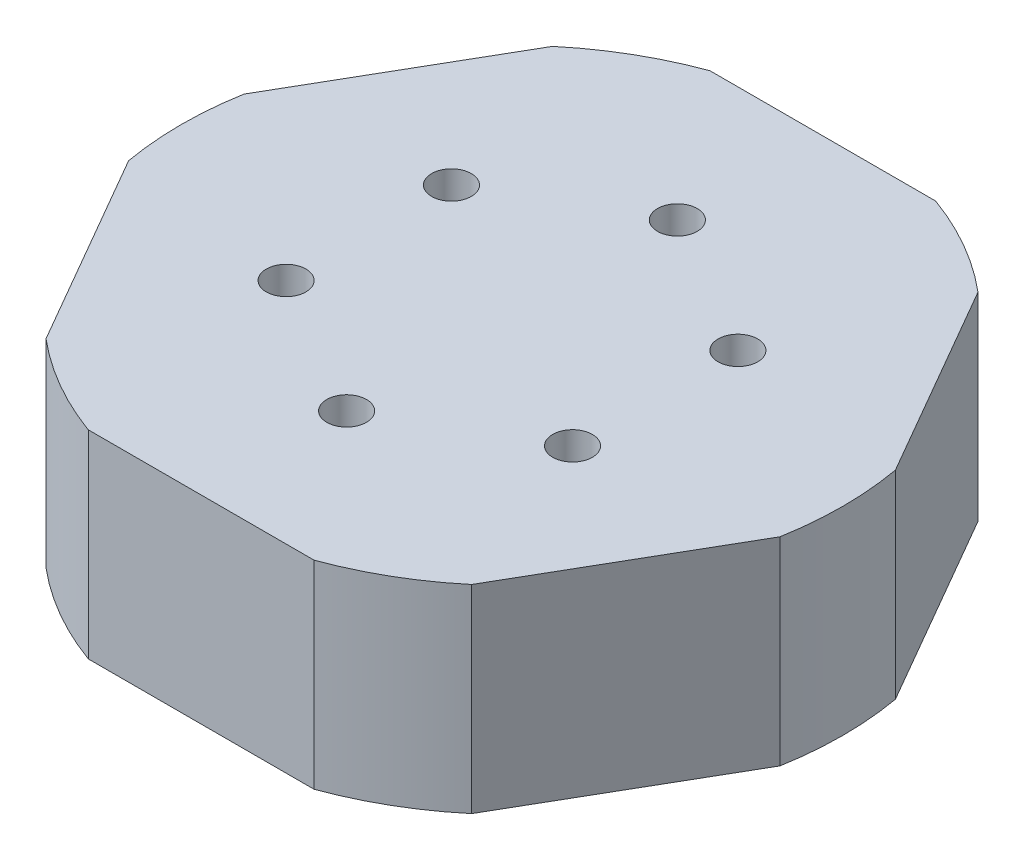
from build123d import *

# Parameters (mm, degrees)
SKETCH2_R                = 40
BOSS_EXTRUDE1_DEPTH      = 10
EXTRUDE_THIN1_DEPTH      = 20
EXTRUDE_THIN1_DEPTH_BACK = 10
SKETCH3_R                = 50
SKETCH3_R_2              = 40
SKETCH4_OUTSIDE_W        = 130.914
SKETCH4_OUTSIDE_H        = 130.914
CUT_EXTRUDE1_DEPTH       = 77.811457479
SKETCH5_R                = 3
CUT_EXTRUDE2_DEPTH       = 75.893257373


with BuildPart() as part:
    # Sketch2 → Boss-Extrude1 (new body)
    with BuildSketch(Plane(origin=(0, 0, 0), x_dir=(1, 0, 0), z_dir=(0, 1, 0))):
        with Locations(Location((0, 0, 0), (0, 0, 270))):
            Circle(SKETCH2_R)
    extrude(amount=BOSS_EXTRUDE1_DEPTH)

    # Sketch3 → Extrude-Thin1 (add, two sides: drawn at the far end of the back side and taken through both)
    with BuildSketch(Plane.XZ.offset(-EXTRUDE_THIN1_DEPTH_BACK)):
        Circle(SKETCH3_R)
        Circle(SKETCH3_R_2, mode=Mode.SUBTRACT)
    extrude(amount=EXTRUDE_THIN1_DEPTH + EXTRUDE_THIN1_DEPTH_BACK)

    # Sketch4 outside → Cut-Extrude1 (cut, through all)
    with BuildSketch(Plane(origin=(0, 10, 0), x_dir=(1, 0, 0), z_dir=(0, 1, 0))):
        Rectangle(SKETCH4_OUTSIDE_W, SKETCH4_OUTSIDE_H)
        Polygon((54.270925304, 0), (27.135462652, 47), (-27.135462652, 47), (-54.270925304, 0), (-27.135462652, -47), (27.135462652, -47), align=None, mode=Mode.SUBTRACT)
    extrude(amount=-CUT_EXTRUDE1_DEPTH, mode=Mode.SUBTRACT)

    # Sketch5 → Cut-Extrude2 (cut, through all)
    with BuildSketch(Plane(origin=(0, 10, 0), x_dir=(1, 0, 0), z_dir=(0, 1, 0))):
        with Locations(Location((0, 25, 0), (0, 0, 270))):
            Circle(SKETCH5_R)
        with Locations(Location((21.650635095, 12.5, 0), (0, 0, 270))):
            Circle(SKETCH5_R)
        with Locations(Location((21.650635095, -12.5, 0), (0, 0, 270))):
            Circle(SKETCH5_R)
        with Locations(Location((0, -25, 0), (0, 0, 270))):
            Circle(SKETCH5_R)
        with Locations(Location((-21.650635095, -12.5, 0), (0, 0, 270))):
            Circle(SKETCH5_R)
        with Locations(Location((-21.650635095, 12.5, 0), (0, 0, 270))):
            Circle(SKETCH5_R)
    extrude(amount=-CUT_EXTRUDE2_DEPTH, mode=Mode.SUBTRACT)


solid = part.part
